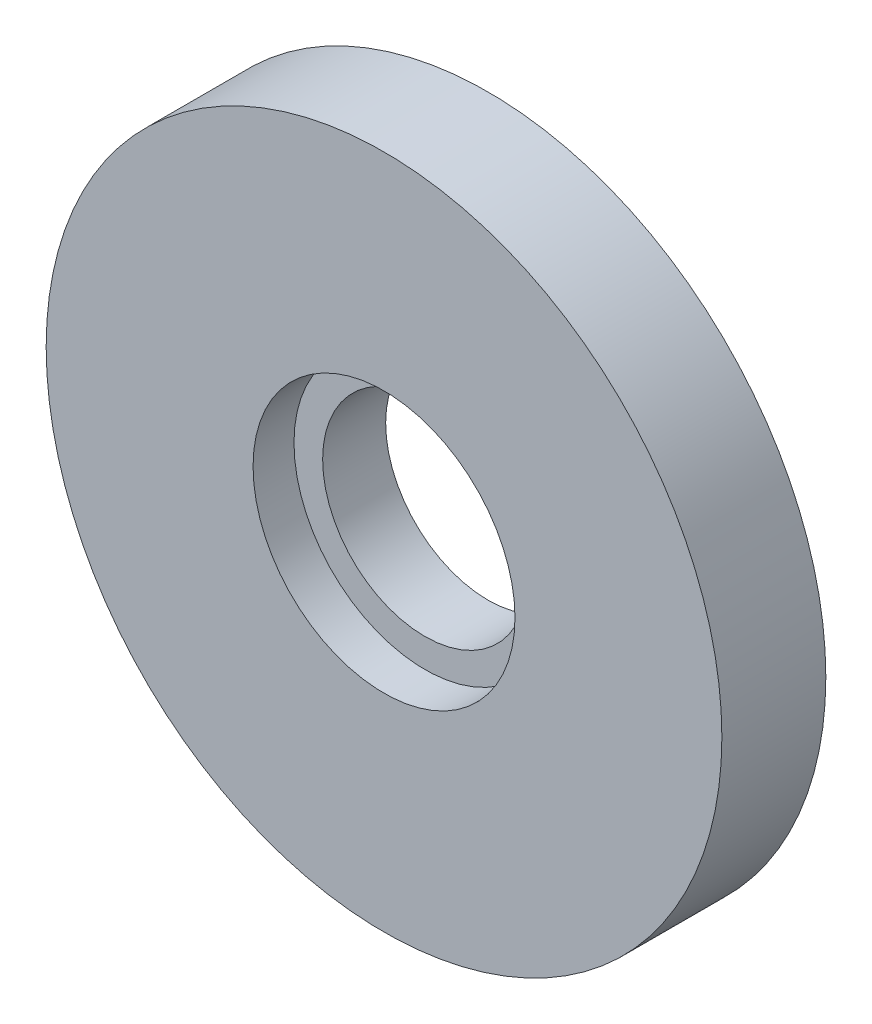
from build123d import *

# Parameters (mm, degrees)
SKETCH1_R               = 41.275
BOSS_EXTRUDE1_DEPTH     = 6.35
CUT_EXTRUDE1_DEPTH      = 60.737268518
CUT_EXTRUDE1_DEPTH_BACK = 60.737268518
SKETCH2_R               = 12.500000019
SKETCH3_R               = 16.000000004
CUT_EXTRUDE2_DEPTH      = 5


with BuildPart() as part:
    # Sketch1 → Boss-Extrude1 (new, symmetric)
    with BuildSketch(Plane.XY):
        Circle(SKETCH1_R)
    extrude(amount=BOSS_EXTRUDE1_DEPTH, both=True)

    # Sketch2 → Cut-Extrude1 (cut, two sides: drawn at the far end of the back side and taken through both)
    with BuildSketch(Plane.XY.offset(6.35).offset(-CUT_EXTRUDE1_DEPTH_BACK)):
        Circle(SKETCH2_R)
    extrude(amount=CUT_EXTRUDE1_DEPTH + CUT_EXTRUDE1_DEPTH_BACK, mode=Mode.SUBTRACT)

    # Sketch3 → Cut-Extrude2 (cut)
    with BuildSketch(Plane.XY.offset(6.35)):
        Circle(SKETCH3_R)
    extrude(amount=-CUT_EXTRUDE2_DEPTH, mode=Mode.SUBTRACT)


solid = part.part
